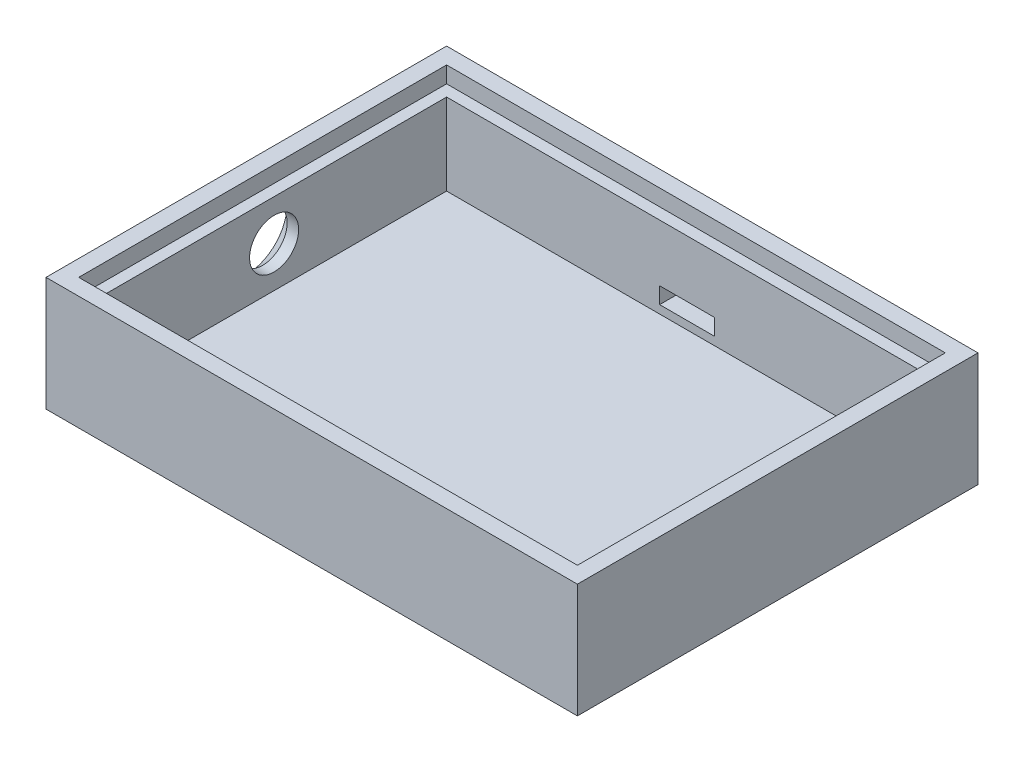
from build123d import *

# Parameters (mm, degrees)
SKETCH1_W           = 325
SKETCH1_H           = 245
BOSS_EXTRUDE1_DEPTH = 10
SKETCH2_W           = 325
SKETCH2_H           = 245
SKETCH2_W_2         = 291
SKETCH2_H_2         = 211
BOSS_EXTRUDE2_DEPTH = 49.8
SKETCH3_W           = 325
SKETCH3_H           = 245
SKETCH3_W_2         = 305
SKETCH3_H_2         = 225
BOSS_EXTRUDE3_DEPTH = 10
SKETCH4_R           = 15
CUT_EXTRUDE1_DEPTH  = 30
CHAMFER1_SIZE       = 10
SKETCH5_W           = 24
SKETCH5_H           = 10
CUT_EXTRUDE2_DEPTH  = 289.552057695
SKETCH6_W           = 33.4
SKETCH6_H           = 10
CUT_EXTRUDE3_DEPTH  = 10


with BuildPart() as part:
    # Sketch1 → Boss-Extrude1 (new body)
    with BuildSketch(Plane(origin=(0, 0, 0), x_dir=(1, 0, 0), z_dir=(0, 1, 0))):
        Rectangle(SKETCH1_W, SKETCH1_H)
    extrude(amount=BOSS_EXTRUDE1_DEPTH)

    # Sketch2 → Boss-Extrude2 (add)
    with BuildSketch(Plane(origin=(0, 10, 0), x_dir=(1, 0, 0), z_dir=(0, 1, 0))):
        Rectangle(SKETCH2_W, SKETCH2_H)
        Rectangle(SKETCH2_W_2, SKETCH2_H_2, mode=Mode.SUBTRACT)
    extrude(amount=BOSS_EXTRUDE2_DEPTH)

    # Sketch3 → Boss-Extrude3 (add)
    with BuildSketch(Plane(origin=(0, 59.8, 0), x_dir=(1, 0, 0), z_dir=(0, 1, 0))):
        Rectangle(SKETCH3_W, SKETCH3_H)
        Rectangle(SKETCH3_W_2, SKETCH3_H_2, mode=Mode.SUBTRACT)
    extrude(amount=BOSS_EXTRUDE3_DEPTH)

    # Sketch4 → Cut-Extrude1 (cut)
    with BuildSketch(Plane.ZY.offset(162.5)):
        with Locations((0, 34.9)):
            Circle(SKETCH4_R)
    extrude(amount=-CUT_EXTRUDE1_DEPTH, mode=Mode.SUBTRACT)

    # Chamfer1
    chamfer1_edges = [part.edges().sort_by_distance(p)[0] for p in [
        (-162.5, 34.9, -15),
    ]]
    chamfer(chamfer1_edges, length=CHAMFER1_SIZE)

    # Sketch5 → Cut-Extrude2 (cut, through all)
    with BuildSketch(Plane.XY.offset(-105.5)):
        with Locations((1.5, 20)):
            Rectangle(SKETCH5_W, SKETCH5_H)
    extrude(amount=-CUT_EXTRUDE2_DEPTH, mode=Mode.SUBTRACT)

    # Sketch6 → Cut-Extrude3 (cut)
    with BuildSketch(Plane.XY.offset(-105.5)):
        with Locations((1.5, 20)):
            Rectangle(SKETCH6_W, SKETCH6_H)
    extrude(amount=-CUT_EXTRUDE3_DEPTH, mode=Mode.SUBTRACT)


solid = part.part
